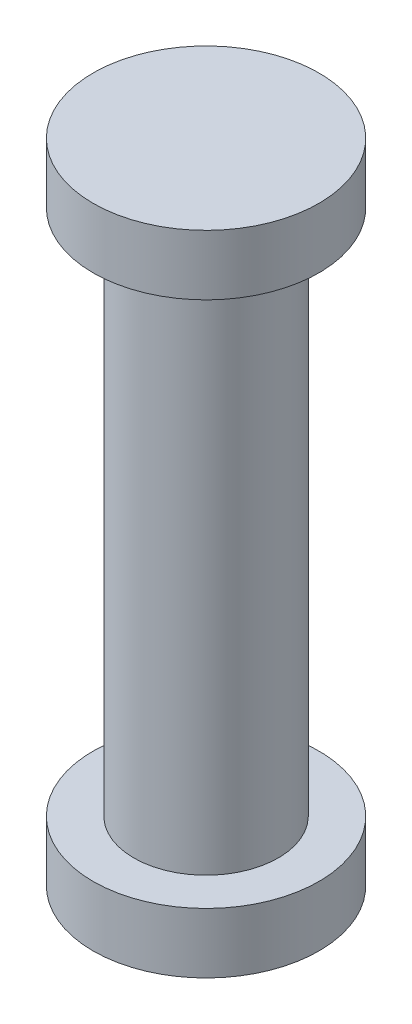
from build123d import *

# Parameters (mm, degrees)
SKETCH1_R           = 3.048
BOSS_EXTRUDE1_DEPTH = 11.1125
SKETCH2_R           = 4.7625
BOSS_EXTRUDE2_DEPTH = 2.54


with BuildPart() as part:
    # Sketch1 → Boss-Extrude1 (new, symmetric)
    with BuildSketch(Plane(origin=(0, 0, 0), x_dir=(1, 0, 0), z_dir=(0, 1, 0))):
        with Locations(Location((0, 0, 0), (0, 0, 270))):
            Circle(SKETCH1_R)
    extrude(amount=BOSS_EXTRUDE1_DEPTH, both=True)

    # Sketch2 → Boss-Extrude2 (add)
    with BuildSketch(Plane(origin=(0, 11.1125, 0), x_dir=(1, 0, 0), z_dir=(0, 1, 0))):
        with Locations(Location((0, 0, 0), (0, 0, 270))):
            Circle(SKETCH2_R)
    boss_extrude2 = extrude(amount=BOSS_EXTRUDE2_DEPTH)

    # Mirror1: Boss-Extrude2 across plane
    add(boss_extrude2.mirror(Plane.ZX))


solid = part.part
